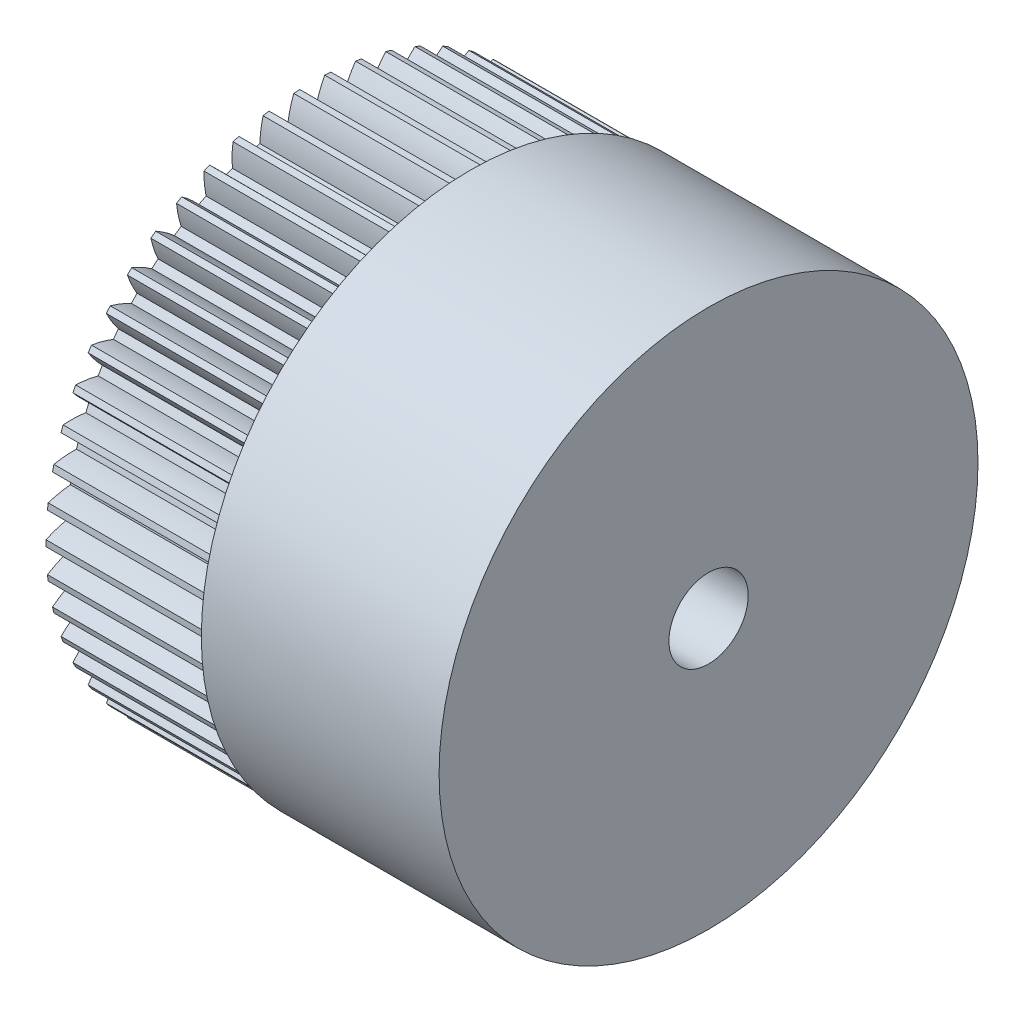
from build123d import *

# Parameters (mm, degrees)
BASPROSKE_W         = 10
BASPROSKE_H         = 16.8
TOOTHCUT_DEPTH      = 26.777509577
TEETHCUTS_COUNT     = 54
TEETHCUTS_ANGLE     = 353.333333333
BORSKE_R            = 2
BORE_DEPTH          = 50.0009652
BOSS_EXTRUDE1_START = 15
SKETCH1_R           = 17
SKETCH1_R_2         = 2
BOSS_EXTRUDE1_DEPTH = 15
SKETCH2_R           = 2.5
CUT_EXTRUDE1_DEPTH  = 5


with BuildPart() as part:
    # BasProSke → Base-Revolve (revolve)
    with BuildSketch(Plane(origin=(0, 0, 0), x_dir=(1, 0, 0), z_dir=(0, 1, 0)), mode=Mode.PRIVATE) as base_revolve_sk:
        with Locations((5, 8.4)):
            Rectangle(BASPROSKE_W, BASPROSKE_H)
    revolve(base_revolve_sk.sketch.rotate(Axis((-10, 0, 0), (1, 0, 0)), 180), axis=Axis((-10, 0, 0), (1, 0, 0)))

    # TooCutSke → ToothCut (cut, through all)
    with BuildSketch(Plane(origin=(0, 0, 0), x_dir=(0, 0, -1), z_dir=(1, 0, 0))):
        with BuildLine():
            ThreePointArc((0.260831852, 15.446797977), (0, 15.449), (-0.260831852, 15.446797977))
            ThreePointArc((-0.260831852, 15.446797977), (-0.491357596, 16.141835381), (-0.798828381, 16.806426104))
            ThreePointArc((-0.798828381, 16.806426104), (0, 16.8254), (0.798828381, 16.806426104))
            ThreePointArc((0.798828381, 16.806426104), (0.491357596, 16.141835381), (0.260831852, 15.446797977))
        make_face()
    toothcut = extrude(amount=TOOTHCUT_DEPTH, mode=Mode.SUBTRACT)

    # TeethCuts: ToothCut ×54 about axis
    teethcuts_axis = Axis((-10, 0, 0), (1, 0, 0))
    for i in range(1, TEETHCUTS_COUNT):
        add(toothcut.rotate(teethcuts_axis, i * TEETHCUTS_ANGLE / (TEETHCUTS_COUNT - 1)), mode=Mode.SUBTRACT)

    # BorSke → Bore (cut, symmetric)
    with BuildSketch(Plane(origin=(0, 0, 0), x_dir=(0, 0, -1), z_dir=(1, 0, 0))):
        with Locations(Location((0, 0, 0), (0, 0, 180))):
            Circle(BORSKE_R)
    extrude(amount=BORE_DEPTH, both=True, mode=Mode.SUBTRACT)

    # Sketch1 → Boss-Extrude1 (add)
    with BuildSketch(Plane(origin=(10, 0, 0), x_dir=(0, 0, -1), z_dir=(1, 0, 0)).offset(BOSS_EXTRUDE1_START)):
        Circle(SKETCH1_R)
        Circle(SKETCH1_R_2, mode=Mode.SUBTRACT)
    extrude(amount=-BOSS_EXTRUDE1_DEPTH)

    # Sketch2 → Cut-Extrude1 (cut)
    with BuildSketch(Plane(origin=(25, 0, 0), x_dir=(0, 0, -1), z_dir=(1, 0, 0))):
        Circle(SKETCH2_R)
    extrude(amount=-CUT_EXTRUDE1_DEPTH, mode=Mode.SUBTRACT)


solid = part.part
